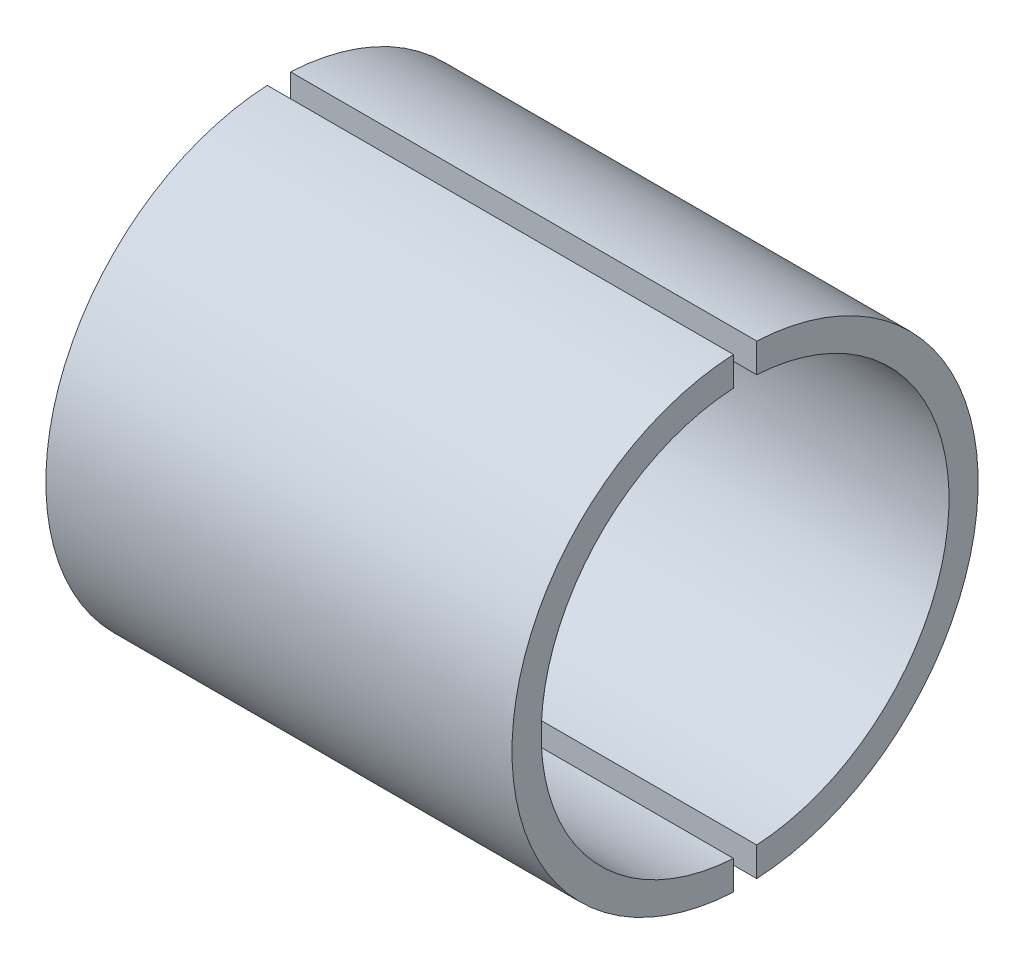
from build123d import *

# Parameters (mm, degrees)
SKETCH_1_R          = 20
EXTRUDE_1_DEPTH     = 40
SKETCH_2_R          = 17.5
CUT_EXTRUDE_1_DEPTH = 40
SKETCH_3_W          = 2
SKETCH_3_H          = 43.604257984
CUT_EXTRUDE_2_DEPTH = 40


with BuildPart() as part:
    # 草图1 → 凸台-拉伸1 (new body)
    with BuildSketch(Plane(origin=(0, 0, 0), x_dir=(0, 0, -1), z_dir=(1, 0, 0))):
        Circle(SKETCH_1_R)
    extrude(amount=EXTRUDE_1_DEPTH)

    # 草图2 → 切除-拉伸1 (cut)
    with BuildSketch(Plane(origin=(40, 0, 0), x_dir=(0, 0, -1), z_dir=(1, 0, 0))):
        Circle(SKETCH_2_R)
    extrude(amount=-CUT_EXTRUDE_1_DEPTH, mode=Mode.SUBTRACT)

    # 草图3 → 切除-拉伸2 (cut)
    with BuildSketch(Plane(origin=(40, 0, 0), x_dir=(0, 0, -1), z_dir=(1, 0, 0))):
        with Locations((0, -0.323473724)):
            Rectangle(SKETCH_3_W, SKETCH_3_H)
    extrude(amount=-CUT_EXTRUDE_2_DEPTH, mode=Mode.SUBTRACT)


with BuildPart() as cut_extrude_2_piece_1:
    # of the separate pieces the step leaves, piece 1, a body of its own (cut_extrude_2_pieces)
    add(part.part.solids().sort_by_distance((0, 19.974984355, 1))[0])


with BuildPart() as cut_extrude_2_piece_2:
    # of the separate pieces the step leaves, piece 2, a body of its own (cut_extrude_2_pieces)
    add(part.part.solids().sort_by_distance((0, -19.974984355, -1))[0])


solid = Compound([cut_extrude_2_piece_1.part, cut_extrude_2_piece_2.part])
